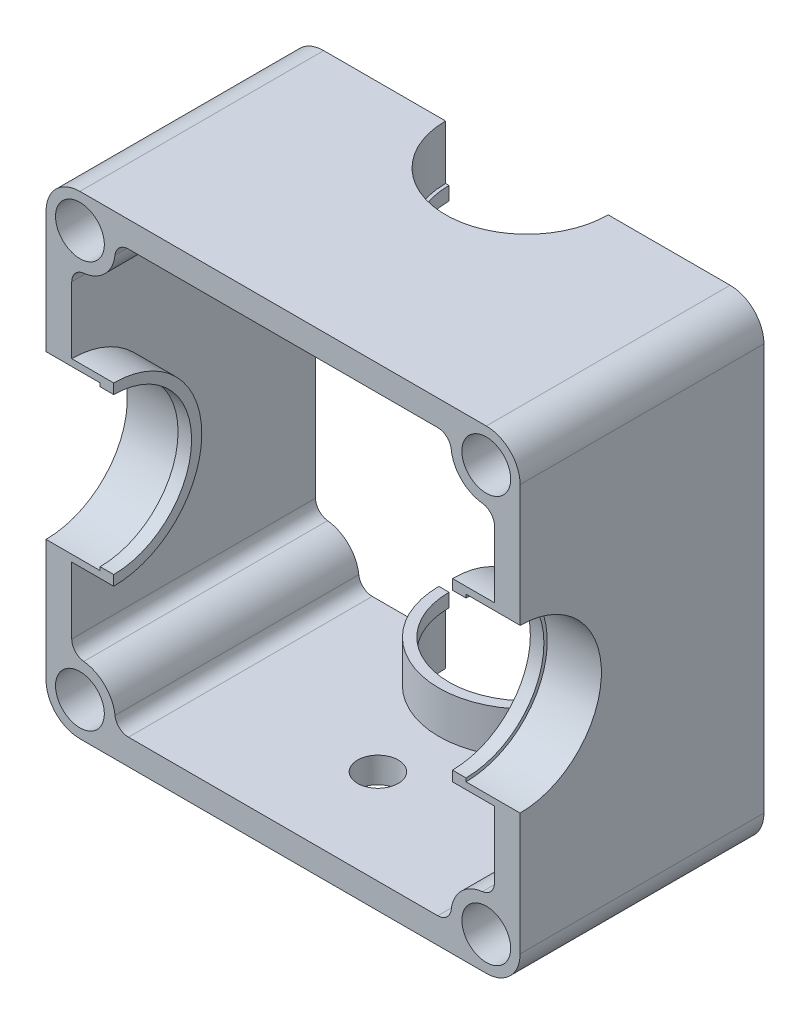
from build123d import *

# Parameters (mm, degrees)
SKETCH_1_R          = 1.8000000000000025
SKETCH_1_R_2        = 1.8000000000000043
SKETCH_1_R_3        = 1.8000000000000005
SKETCH_1_R_4        = 1.8000000000000007
EXTRUDE_1_DEPTH     = 42
SKETCH_2_R          = 6.000000000000001
CUT_EXTRUDE_1_DEPTH = 58.404268133998535
SKETCH_3_R          = 6.000000000000002
CUT_EXTRUDE_2_DEPTH = 58.404268133998535
SKETCH_5_W          = 12
SKETCH_5_H          = 15.000000000000005
SKETCH_5_H_2        = 15.000000000000002
CUT_EXTRUDE_3_DEPTH = 58.404268133998535
EXTRUDE_2_DEPTH     = 2.1
EXTRUDE_3_DEPTH     = 1
EXTRUDE_START       = 2.1
EXTRUDE_4_DEPTH     = 2.1
EXTRUDE_START_2     = 1
EXTRUDE_5_DEPTH     = 1
SKETCH_10_R         = 1.5000000000000018
CUT_EXTRUDE_4_DEPTH = 3


with BuildPart() as part:
    # 草图1 → 凸台-拉伸1 (new body)
    with BuildSketch(Plane(origin=(0, 0, 0), x_dir=(-1, 0, 0), z_dir=(0, 0, 1))):
        with BuildLine():
            Line((-17.499999999999996, 15), (-17.499999999999996, -15.000000000000007))
            ThreePointArc((-17.499999999999996, -15.000000000000007), (-16.767766952966365, -16.767766952966372), (-15, -17.500000000000007))
            Line((-15, -17.500000000000007), (15.000000000000004, -17.500000000000007))
            ThreePointArc((15.000000000000004, -17.500000000000007), (16.76776695296637, -16.767766952966376), (17.5, -15.00000000000001))
            Line((17.5, -15.00000000000001), (17.5, 14.999999999999996))
            ThreePointArc((17.5, 14.999999999999996), (16.76776695296637, 16.76776695296636), (15.000000000000004, 17.499999999999996))
            Line((15.000000000000004, 17.499999999999996), (-15, 17.499999999999996))
            ThreePointArc((-15, 17.499999999999996), (-16.767766952966365, 16.767766952966365), (-17.499999999999996, 15))
        make_face()
        with Locations((-15.000000000000004, -15.00000000000001)):
            Circle(SKETCH_1_R, mode=Mode.SUBTRACT)
        with Locations((15.000000000000004, -15.00000000000001)):
            Circle(SKETCH_1_R_2, mode=Mode.SUBTRACT)
        with Locations((15.000000000000004, 14.999999999999996)):
            Circle(SKETCH_1_R_3, mode=Mode.SUBTRACT)
        with Locations((-15, 15)):
            Circle(SKETCH_1_R_4, mode=Mode.SUBTRACT)
        with BuildLine():
            Line((15.604722413530899, -11.417049414734192), (15.604722413530899, 11.41704941481964))
            ThreePointArc((15.604722413530899, 11.41704941481964), (15.349600753639777, 12.084241863325458), (14.714404940145743, 12.41098197902667))
            ThreePointArc((14.714404940145743, 12.41098197902667), (13.158183898644735, 13.15818233801838), (12.410982220986185, 14.714402746377065))
            ThreePointArc((12.410982220986185, 14.714402746377065), (12.084242685294747, 15.349600017363324), (11.417049414775391, 15.604722413530212))
            Line((11.417049414775391, 15.604722413530212), (-11.417049414778536, 15.604722413530212))
            ThreePointArc((-11.417049414778536, 15.604722413530212), (-12.084241863278942, 15.349600753643644), (-12.410981978984013, 14.714404940159108))
            ThreePointArc((-12.410981978984013, 14.714404940159108), (-13.158182337972896, 13.158183898648431), (-14.714402746337697, 12.41098222098531))
            ThreePointArc((-14.714402746337697, 12.41098222098531), (-15.34960001732269, 12.084242685293246), (-15.604722413489107, 11.41704941477461))
            Line((-15.604722413489107, 11.41704941477461), (-15.604722413489107, -11.417049414779225))
            ThreePointArc((-15.604722413489107, -11.417049414779225), (-15.349600753597985, -12.084241863285039), (-14.714404940103952, -12.410981978986248))
            ThreePointArc((-14.714404940103952, -12.410981978986248), (-13.158183898602942, -13.158182337977962), (-12.410982220944396, -14.714402746336651))
            ThreePointArc((-12.410982220944396, -14.714402746336651), (-12.084242685252958, -15.34960001732291), (-11.417049414733604, -15.604722413489796))
            Line((-11.417049414733604, -15.604722413489796), (11.417049414820326, -15.604722413489796))
            ThreePointArc((11.417049414820326, -15.604722413489796), (12.084241863320731, -15.349600753603227), (12.410981979025802, -14.714404940118692))
            ThreePointArc((12.410981979025802, -14.714404940118692), (13.158182338014687, -13.158183898608014), (14.71440274637949, -12.410982220944893))
            ThreePointArc((14.71440274637949, -12.410982220944893), (15.34960001736448, -12.084242685252828), (15.604722413530899, -11.417049414734192))
        make_face(mode=Mode.SUBTRACT)
    extrude(amount=EXTRUDE_1_DEPTH)

    # 草图2 → 切除-拉伸1 (cut, through all)
    with BuildSketch(Plane(origin=(0, 17.500000000000007, 0), x_dir=(1, 0, 0), z_dir=(0, 1, 0))):
        with Locations(Location((0, -11.999999999999998, 0), (0, 0, 270))):
            Circle(SKETCH_2_R)
    extrude(amount=-CUT_EXTRUDE_1_DEPTH, mode=Mode.SUBTRACT)

    # 草图3 → 切除-拉伸2 (cut, through all)
    with BuildSketch(Plane.ZY.offset(17.5)):
        with Locations((30, 0)):
            Circle(SKETCH_3_R)
    extrude(amount=-CUT_EXTRUDE_2_DEPTH, mode=Mode.SUBTRACT)

    # 草图5 → 切除-拉伸3 (cut, through all)
    with BuildSketch(Plane(origin=(17.499999999999996, 0, 0), x_dir=(0, 0, -1), z_dir=(1, 0, 0))):
        Polygon((-30, -24.974265818952347), (-30, -15), (-42, -15), (-42, 15.000000000000007), (-30, 15.000000000000007), (-30, 23.87950348168345), (-47.41212790980853, 25.238249525472156), (-47.41212790980853, -24.974265818952347), align=None)
        with BuildLine():
            Line((-42, -15), (-30, -15))
            Line((-30, -15), (-30, -6.000000000000003))
            ThreePointArc((-29.999999999999925, -6.000000000000003), (-36, -1.93e-15), (-29.999999999999932, 6.000000000000003))
            Line((-30, 6.000000000000003), (-30, 15.000000000000007))
            Line((-30, 15.000000000000007), (-42, 15.000000000000007))
            Line((-42, 15.000000000000007), (-42, -15))
        make_face()
        with Locations((-6, 7.500000000000003)):
            Rectangle(SKETCH_5_W, SKETCH_5_H)
        Polygon((0, 15.000000000000007), (0, 0), (0, -15), (-12, -15), (-12, -24.974265818952347), (12.116605042765016, -24.974265818952347), (12.116605042765016, 23.87950348168345), (-12, 23.87950348168345), (-12, 15.000000000000007), align=None)
        with Locations((-6, -7.500000000000001)):
            Rectangle(SKETCH_5_W, SKETCH_5_H_2)
    extrude(amount=-CUT_EXTRUDE_3_DEPTH, mode=Mode.SUBTRACT)

    # 草图6 → 凸台-拉伸2 (add)
    with BuildSketch(Plane(origin=(0, 15.604722413489796, 0), x_dir=(-1, 0, 0), z_dir=(0, -1, 0))):
        with BuildLine():
            Line((-6.000000000000001, -11.999999999999998), (-6.500000000000001, -11.999999999999998))
            ThreePointArc((-6.500000000000001, -11.999999999999998), (-1.19e-15, -18.5), (6.500000000000001, -11.999999999999998))
            Line((6.500000000000001, -11.999999999999998), (6.000000000000001, -11.999999999999998))
            ThreePointArc((6.000000000000001, -11.999999999999998), (-1.1e-15, -18), (-6.000000000000001, -11.999999999999998))
        make_face()
    extrude_2 = extrude(amount=EXTRUDE_2_DEPTH)

    # 草图7 → 凸台-拉伸3 (add)
    with BuildSketch(Plane(origin=(0, 13.504722413489795, 0), x_dir=(-1, 0, 0), z_dir=(0, -1, 0))):
        with BuildLine():
            Line((-6.500000000000002, -11.999999999999998), (-5.750000000000001, -11.999999999999998))
            ThreePointArc((-5.750000000000001, -11.999999999999998), (-1.06e-15, -17.75), (5.750000000000001, -11.999999999999998))
            Line((5.750000000000001, -11.999999999999998), (6.500000000000002, -11.999999999999998))
            ThreePointArc((6.500000000000002, -11.999999999999998), (-1.19e-15, -18.5), (-6.500000000000002, -11.999999999999998))
        make_face()
    extrude_3 = extrude(amount=EXTRUDE_3_DEPTH)

    # 镜向1: 凸台-拉伸2, 凸台-拉伸3 across plane
    add(extrude_2.mirror(Plane(origin=(0, 0, 0), x_dir=(0, 0, 1), z_dir=(0, -1, 0))))
    add(extrude_3.mirror(Plane(origin=(0, 0, 0), x_dir=(0, 0, 1), z_dir=(0, -1, 0))))

    # 草图8 → 凸台-拉伸4 (add)
    with BuildSketch(Plane.ZY.offset(-15.604722413489107).offset(EXTRUDE_START)):
        with BuildLine():
            Line((30, -6.500000000000001), (30, -6.000000000000003))
            ThreePointArc((30, -6.000000000000003), (23.999999999999996, 7.3e-16), (30, 6.000000000000003))
            Line((30, 6.000000000000003), (30, 6.500000000000001))
            ThreePointArc((30, 6.500000000000001), (23.5, 8e-16), (30, -6.500000000000001))
        make_face()
    extrude_4 = extrude(amount=-EXTRUDE_4_DEPTH)

    # 草图9 → 凸台-拉伸5 (add)
    with BuildSketch(Plane.ZY.offset(-13.504722413489107).offset(EXTRUDE_START_2)):
        with BuildLine():
            Line((30, -6.500000000000001), (30, -5.750000000000003))
            ThreePointArc((30, -5.750000000000003), (24.249999999999996, 7e-16), (30, 5.750000000000003))
            Line((30, 5.750000000000003), (30, 6.500000000000001))
            ThreePointArc((30, 6.500000000000001), (23.5, 8e-16), (30, -6.500000000000001))
        make_face()
    extrude_5 = extrude(amount=-EXTRUDE_5_DEPTH)

    # 镜向2: 凸台-拉伸4, 凸台-拉伸5 across plane
    add(extrude_4.mirror(Plane.ZY))
    add(extrude_5.mirror(Plane.ZY))

    # 草图10 → 切除-拉伸4 (cut)
    with BuildSketch(Plane.XZ.offset(17.499999999999996)):
        with Locations(Location((-1.8416814e-09, 23.000000000000025, 0), (0, 0, 270))):
            Circle(SKETCH_10_R)
    extrude(amount=-CUT_EXTRUDE_4_DEPTH, mode=Mode.SUBTRACT)


solid = part.part
